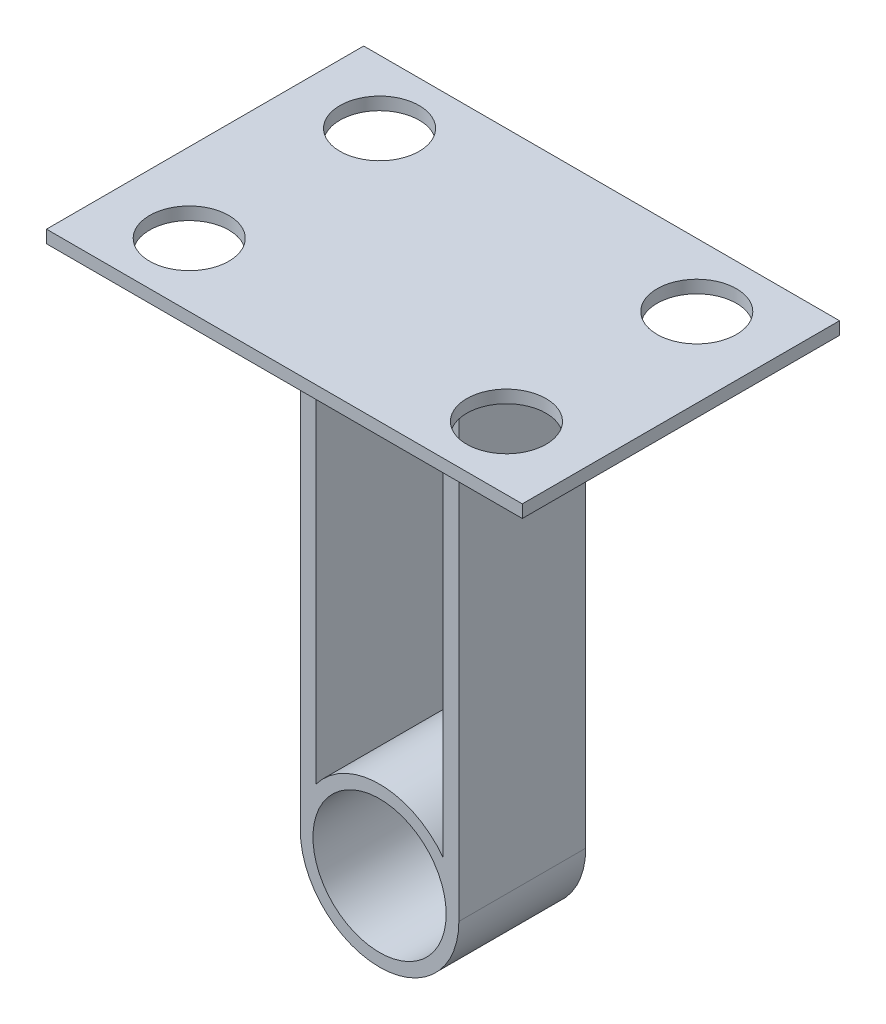
from build123d import *

# Parameters (mm, degrees)
SKETCH1_R           = 2.667
BOSS_EXTRUDE1_DEPTH = 5.08
SKETCH2_W           = 19.05
SKETCH2_H           = 12.7
BOSS_EXTRUDE2_DEPTH = 0.508
SKETCH4_R           = 1.5875
CUT_EXTRUDE1_DEPTH  = 26.762537724


with BuildPart() as part:
    # Sketch1 → Boss-Extrude1 (new body)
    with BuildSketch(Plane.XY):
        with BuildLine():
            Line((-3.175, 0), (-3.175, 19.05))
            Line((-3.175, 19.05), (-2.54, 19.05))
            Line((-2.54, 19.05), (-2.54, 1.905))
            ThreePointArc((-2.54, 1.905), (0, 3.175), (2.54, 1.905))
            Line((2.54, 1.905), (2.54, 19.05))
            Line((2.54, 19.05), (3.175, 19.05))
            Line((3.175, 19.05), (3.175, 0))
            ThreePointArc((3.175, 0), (0, -3.175), (-3.175, 0))
        make_face()
        Circle(SKETCH1_R, mode=Mode.SUBTRACT)
    extrude(amount=BOSS_EXTRUDE1_DEPTH)

    # Sketch2 → Boss-Extrude2 (add)
    with BuildSketch(Plane(origin=(0, 19.05, 0), x_dir=(1, 0, 0), z_dir=(0, 1, 0))):
        with Locations((0, -2.54)):
            Rectangle(SKETCH2_W, SKETCH2_H)
    extrude(amount=BOSS_EXTRUDE2_DEPTH)

    # Sketch4 → Cut-Extrude1 (cut, through all)
    with BuildSketch(Plane.XZ.offset(-19.05)):
        with Locations(Location((-6.35, 6.35, 0), (0, 0, 270))):
            Circle(SKETCH4_R)
        with Locations(Location((6.35, 6.35, 0), (0, 0, 270))):
            Circle(SKETCH4_R)
        with Locations(Location((6.35, -1.27, 0), (0, 0, 90))):
            Circle(SKETCH4_R)
        with Locations(Location((-6.35, -1.27, 0), (0, 0, 90))):
            Circle(SKETCH4_R)
    extrude(amount=-CUT_EXTRUDE1_DEPTH, mode=Mode.SUBTRACT)


solid = part.part
